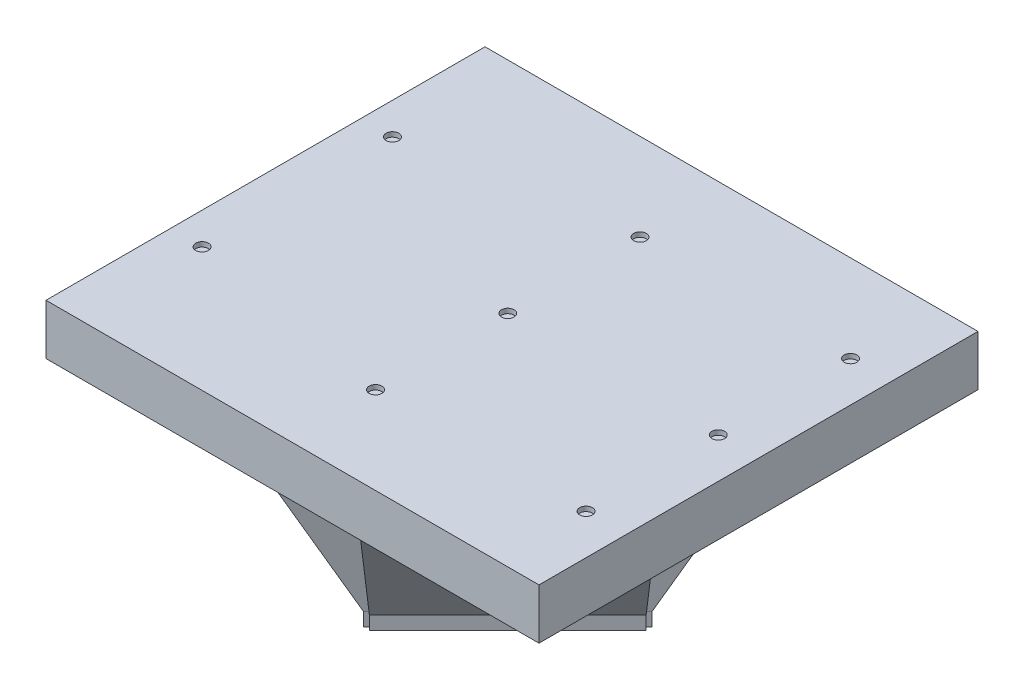
from build123d import *

# Parameters (mm, degrees)
SKETCH1_W           = 93.2
SKETCH1_H           = 83
BOSS_EXTRUDE1_DEPTH = 9.55
BOSS_EXTRUDE3_DEPTH = 2.5
SKETCH6_R           = 1.2
CUT_EXTRUDE1_DEPTH  = 0.9


with BuildPart() as part:
    # Sketch1 → Boss-Extrude1 (new body)
    with BuildSketch(Plane(origin=(0, 0, 0), x_dir=(1, 0, 0), z_dir=(0, 1, 0))):
        Rectangle(SKETCH1_W, SKETCH1_H)
    extrude(amount=-BOSS_EXTRUDE1_DEPTH)

    # Sketch3 → Loft3 section 0
    with BuildSketch(Plane(origin=(0, -35.75, 0), x_dir=(-1, 0, 0), z_dir=(0, -1, 0))):
        with BuildLine():
            Line((0.25082265, 26.712128254), (-25.912128254, 0.54917735))
            Line((-25.912128254, 0.54917735), (-25.362950904, 0))
            Line((-25.362950904, 0), (-25.912128254, -0.54917735))
            Line((-25.912128254, -0.54917735), (0.25082265, -26.712128254))
            Line((0.25082265, -26.712128254), (0.8, -26.162950904))
            Line((0.8, -26.162950904), (1.34917735, -26.712128254))
            Line((1.34917735, -26.712128254), (27.512128254, -0.54917735))
            Line((27.512128254, -0.54917735), (26.962950904, 0))
            Line((26.962950904, 0), (27.512128254, 0.54917735))
            Line((27.512128254, 0.54917735), (1.34917735, 26.712128254))
            Line((1.34917735, 26.712128254), (0.8, 26.162950904))
            Line((0.8, 26.162950904), (0.25082265, 26.712128254))
        make_face()
    # Sketch2 → Loft3 section 1
    with BuildSketch(Plane.XZ.offset(9.55)):
        with BuildLine():
            Line((-10.718342201, -38.202613448), (-0.8, -28.284271247))
            Line((-0.8, -28.284271247), (9.118342201, -38.202613448))
            Line((9.118342201, -38.202613448), (37.402613448, -9.918342201))
            Line((37.402613448, -9.918342201), (27.484271247, 0))
            Line((27.484271247, 0), (37.402613448, 9.918342201))
            Line((37.402613448, 9.918342201), (9.118342201, 38.202613448))
            Line((9.118342201, 38.202613448), (-0.8, 28.284271247))
            Line((-0.8, 28.284271247), (-10.718342201, 38.202613448))
            Line((-10.718342201, 38.202613448), (-39.002613448, 9.918342201))
            Line((-39.002613448, 9.918342201), (-29.084271247, 0))
            Line((-29.084271247, 0), (-39.002613448, -9.918342201))
            Line((-39.002613448, -9.918342201), (-10.718342201, -38.202613448))
        make_face()
    loft()

    # Sketch5 → Boss-Extrude3 (add)
    with BuildSketch(Plane.XZ.offset(35.75)):
        Polygon((-0.8, -26.162950904), (-0.25082265, -26.712128254), (25.912128254, -0.54917735), (25.362950904, 0), (25.912128254, 0.54917735), (-0.25082265, 26.712128254), (-0.8, 26.162950904), (-1.34917735, 26.712128254), (-27.512128254, 0.54917735), (-26.962950904, 0), (-27.512128254, -0.54917735), (-1.34917735, -26.712128254), align=None)
    extrude(amount=BOSS_EXTRUDE3_DEPTH)

    # Sketch6 → Cut-Extrude1 (cut)
    with BuildSketch(Plane(origin=(0, 0, 0), x_dir=(1, 0, 0), z_dir=(0, 1, 0))):
        with Locations(Location((39, -25, 0), (0, 0, 270))):
            Circle(SKETCH6_R)
        with Locations(Location((39, 0, 0), (0, 0, 270))):
            Circle(SKETCH6_R)
        with Locations(Location((39, 25, 0), (0, 0, 270))):
            Circle(SKETCH6_R)
        with Locations(Location((-40.6, 18, 0), (0, 0, 270))):
            Circle(SKETCH6_R)
        with Locations(Location((-40.6, -18, 0), (0, 0, 270))):
            Circle(SKETCH6_R)
        with Locations(Location((-0.8, -25, 0), (0, 0, 270))):
            Circle(SKETCH6_R)
        with Locations(Location((-0.8, 0, 0), (0, 0, 270))):
            Circle(SKETCH6_R)
        with Locations(Location((-0.8, 25, 0), (0, 0, 270))):
            Circle(SKETCH6_R)
    extrude(amount=-CUT_EXTRUDE1_DEPTH, mode=Mode.SUBTRACT)


solid = part.part
